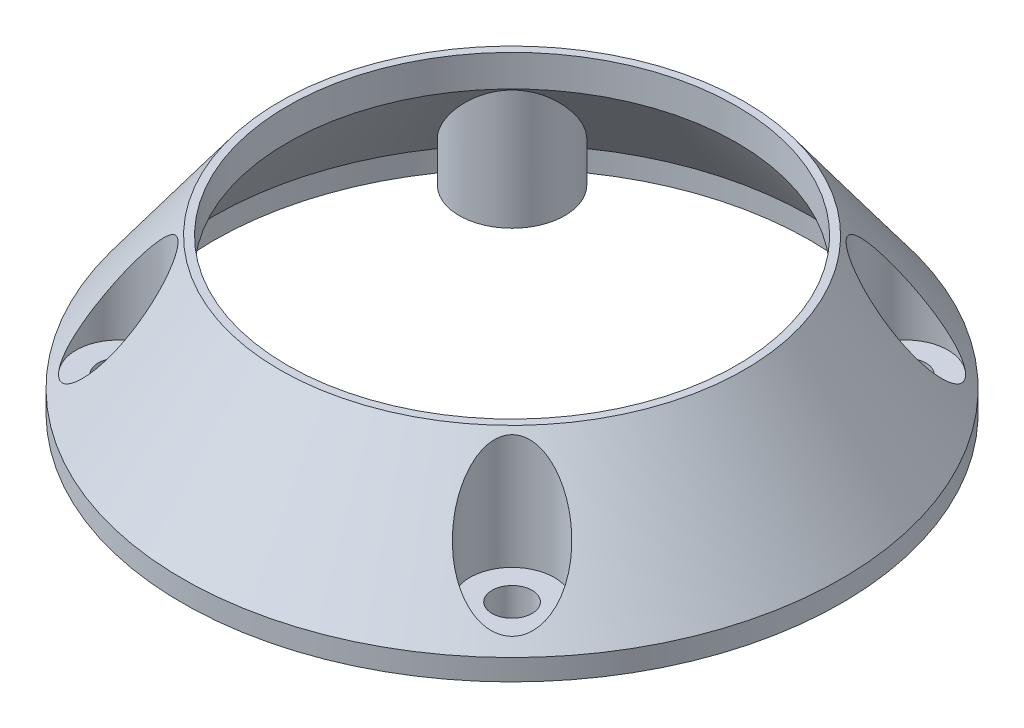
from build123d import *

# Parameters (mm, degrees)
BOSS_EXTRUDE2_REACH = 61.404
SKETCH6_R           = 2.413
CUT_EXTRUDE3_DEPTH  = 60.403601076
SKETCH7_R           = 5.08
CUT_EXTRUDE6_DEPTH  = 15.723362
SKETCH8_R           = 51.318264322
CUT_EXTRUDE7_DEPTH  = 1.27


with BuildPart() as part:
    # Sketch3 → Revolve1 (revolve)
    with BuildSketch(Plane.XY, mode=Mode.PRIVATE) as revolve1_sk:
        Polygon((35.89, 0), (27, 12.094590252), (27, 17.174590252), (39.624, 0), (39.624, -2.54), (35.89, -2.54), align=None)
    revolve(revolve1_sk.sketch.rotate(Axis((0, -74.58294497, 0), (0, 1, 0)), 90), axis=Axis((0, -74.58294497, 0), (0, 1, 0)))

    # Boss-Extrude2: up to this cone (the profile starts inside it)
    boss_extrude2_end = Plane(origin=(0, -2.54, 0), z_dir=(0, -1, 0)).offset(-51.367315551) * Cone(1e-06, 111.011758661, 151.028315551, align=(Align.CENTER, Align.CENTER, Align.MIN), mode=Mode.PRIVATE)
    # Sketch4 → Boss-Extrude2 (add, up to the surface)
    with BuildSketch(Plane.XZ.offset(2.54), mode=Mode.PRIVATE) as boss_extrude2_sk1:
        with BuildLine():
            Line((-19.217748099, 28.19800422), (-20.487557981, 29.467814102))
            ThreePointArc((-20.487557981, 29.467814102), (-25.378062377, 25.378062377), (-29.467814102, 20.487557981))
            Line((-29.467814102, 20.487557981), (-28.19800422, 19.217748099))
            ThreePointArc((-28.19800422, 19.217748099), (-19.217748099, 19.217748099), (-19.217748099, 28.19800422))
        make_face()
    boss_extrude2_tool1 = extrude(boss_extrude2_sk1.sketch, amount=-BOSS_EXTRUDE2_REACH, mode=Mode.PRIVATE) & boss_extrude2_end
    add(boss_extrude2_tool1.solids().sort_by_distance((-22.615414, -2.54, 22.615414))[0])
    # Sketch4 → Boss-Extrude2 (add, up to the surface)
    with BuildSketch(Plane.XZ.offset(2.54), mode=Mode.PRIVATE) as boss_extrude2_sk2:
        with BuildLine():
            Line((28.19800422, 19.217748099), (29.467814102, 20.487557981))
            ThreePointArc((29.467814102, 20.487557981), (25.378062377, 25.378062377), (20.487557981, 29.467814102))
            Line((20.487557981, 29.467814102), (19.217748099, 28.19800422))
            ThreePointArc((19.217748099, 28.19800422), (19.217748099, 19.217748099), (28.19800422, 19.217748099))
        make_face()
    boss_extrude2_tool2 = extrude(boss_extrude2_sk2.sketch, amount=-BOSS_EXTRUDE2_REACH, mode=Mode.PRIVATE) & boss_extrude2_end
    add(boss_extrude2_tool2.solids().sort_by_distance((22.615414, -2.54, 22.615414))[0])
    # Sketch4 → Boss-Extrude2 (add, up to the surface)
    with BuildSketch(Plane.XZ.offset(2.54), mode=Mode.PRIVATE) as boss_extrude2_sk3:
        with BuildLine():
            Line((19.217748099, -28.19800422), (20.487557981, -29.467814102))
            ThreePointArc((20.487557981, -29.467814102), (25.378062377, -25.378062377), (29.467814102, -20.487557981))
            Line((29.467814102, -20.487557981), (28.19800422, -19.217748099))
            ThreePointArc((28.19800422, -19.217748099), (19.217748099, -19.217748099), (19.217748099, -28.19800422))
        make_face()
    boss_extrude2_tool3 = extrude(boss_extrude2_sk3.sketch, amount=-BOSS_EXTRUDE2_REACH, mode=Mode.PRIVATE) & boss_extrude2_end
    add(boss_extrude2_tool3.solids().sort_by_distance((22.615414, -2.54, -22.615414))[0])
    # Sketch4 → Boss-Extrude2 (add, up to the surface)
    with BuildSketch(Plane.XZ.offset(2.54), mode=Mode.PRIVATE) as boss_extrude2_sk4:
        with BuildLine():
            Line((-28.19800422, -19.217748099), (-29.467814102, -20.487557981))
            ThreePointArc((-29.467814102, -20.487557981), (-25.378062377, -25.378062377), (-20.487557981, -29.467814102))
            Line((-20.487557981, -29.467814102), (-19.217748099, -28.19800422))
            ThreePointArc((-19.217748099, -28.19800422), (-19.217748099, -19.217748099), (-28.19800422, -19.217748099))
        make_face()
    boss_extrude2_tool4 = extrude(boss_extrude2_sk4.sketch, amount=-BOSS_EXTRUDE2_REACH, mode=Mode.PRIVATE) & boss_extrude2_end
    add(boss_extrude2_tool4.solids().sort_by_distance((-22.615414, -2.54, -22.615414))[0])

    # Sketch6 → Cut-Extrude3 (cut, through all)
    with BuildSketch(Plane.XZ.offset(2.54)):
        with Locations(Location((-23.671955135, 23.671955135, 0), (0, 0, 270))):
            Circle(SKETCH6_R)
        with Locations(Location((23.671955135, 23.671955135, 0), (0, 0, 45))):
            Circle(SKETCH6_R)
        with Locations(Location((23.671955135, -23.671955135, 0), (0, 0, 270))):
            Circle(SKETCH6_R)
        with Locations(Location((-23.671955135, -23.671955135, 0), (0, 0, 225))):
            Circle(SKETCH6_R)
    extrude(amount=-CUT_EXTRUDE3_DEPTH, mode=Mode.SUBTRACT)

    # Sketch7 → Cut-Extrude6 (cut)
    with BuildSketch(Plane(origin=(0, 17.174590252, 0), x_dir=(1, 0, 0), z_dir=(0, 1, 0))):
        with Locations(Location((-23.671955135, 23.671955135, 0), (0, 0, 270))):
            Circle(SKETCH7_R)
        with Locations(Location((23.671955135, 23.671955135, 0), (0, 0, 270))):
            Circle(SKETCH7_R)
        with Locations(Location((23.671955135, -23.671955135, 0), (0, 0, 270))):
            Circle(SKETCH7_R)
        with Locations(Location((-23.671955135, -23.671955135, 0), (0, 0, 270))):
            Circle(SKETCH7_R)
    extrude(amount=-CUT_EXTRUDE6_DEPTH, mode=Mode.SUBTRACT)

    # Sketch8 → Cut-Extrude7 (cut)
    with BuildSketch(Plane(origin=(0, 17.174590252, 0), x_dir=(1, 0, 0), z_dir=(0, 1, 0))):
        Circle(SKETCH8_R)
    extrude(amount=-CUT_EXTRUDE7_DEPTH, mode=Mode.SUBTRACT)


solid = part.part
